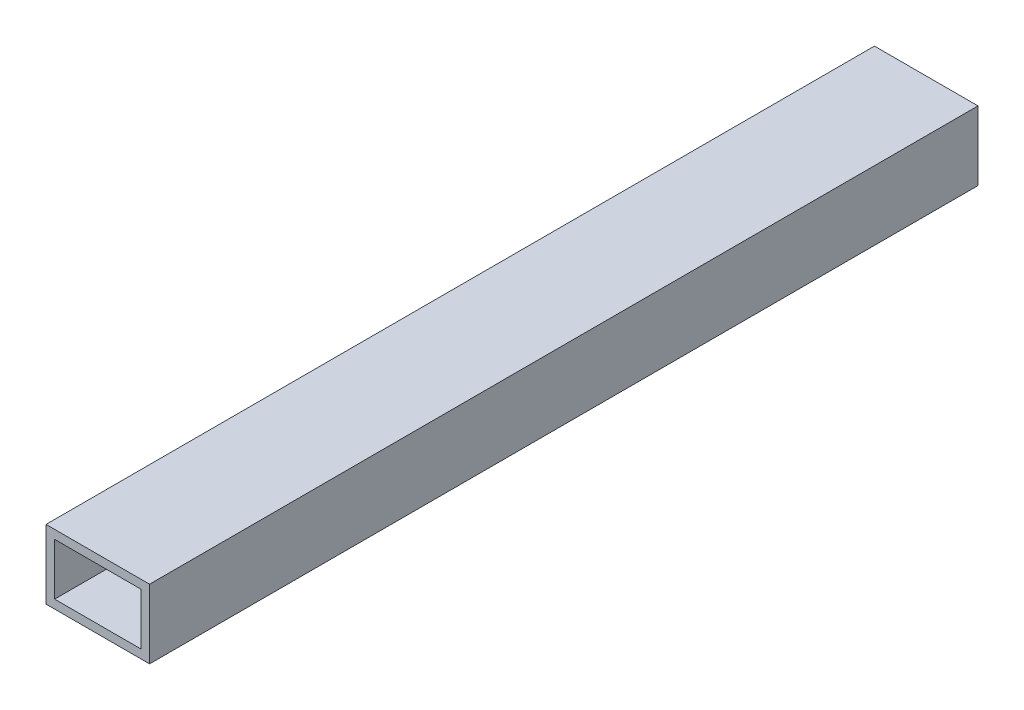
from build123d import *

# Parameters (mm, degrees)
SKETCH1_W           = 38.1
SKETCH1_H           = 25.4
BOSS_EXTRUDE1_DEPTH = 304.8
SHELL1_T            = -3.175


with BuildPart() as part:
    # Sketch1 → Boss-Extrude1 (new body)
    with BuildSketch(Plane.XY):
        Rectangle(SKETCH1_W, SKETCH1_H)
    extrude(amount=BOSS_EXTRUDE1_DEPTH)

    # Shell1
    shell1_openings = [part.faces().sort_by_distance(p)[0] for p in [
        (0, 0, 304.8),
        (0, 0, 0),
    ]]
    offset(amount=SHELL1_T, openings=shell1_openings, kind=Kind.INTERSECTION)


solid = part.part
